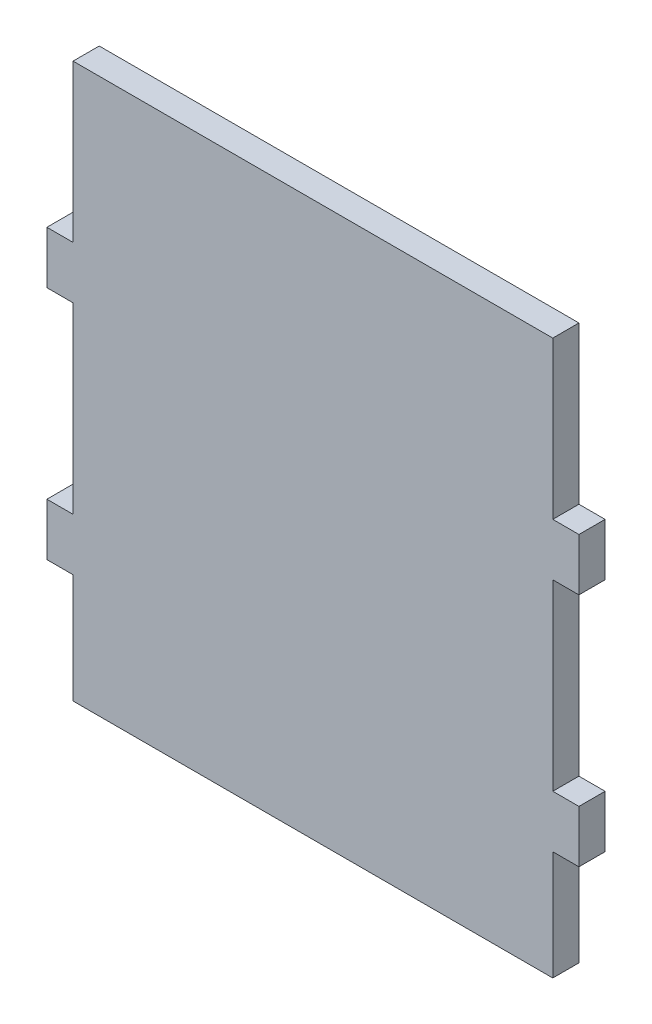
from build123d import *

# Parameters (mm, degrees)
P_IDAT_VYSUNUT_M1_DEPTH = 3


with BuildPart() as part:
    # Skica1 → Přidat vysunutím1 (new body)
    with BuildSketch(Plane.XY):
        Polygon((0, 0), (55, 0), (55, -18), (58, -18), (58, -24), (55, -24), (55, -45), (58, -45), (58, -51), (55, -51), (55, -63.54), (0, -63.54), (0, -51), (-3, -51), (-3, -45), (0, -45), (0, -24), (-3, -24), (-3, -18), (0, -18), align=None)
    extrude(amount=P_IDAT_VYSUNUT_M1_DEPTH)


solid = part.part
